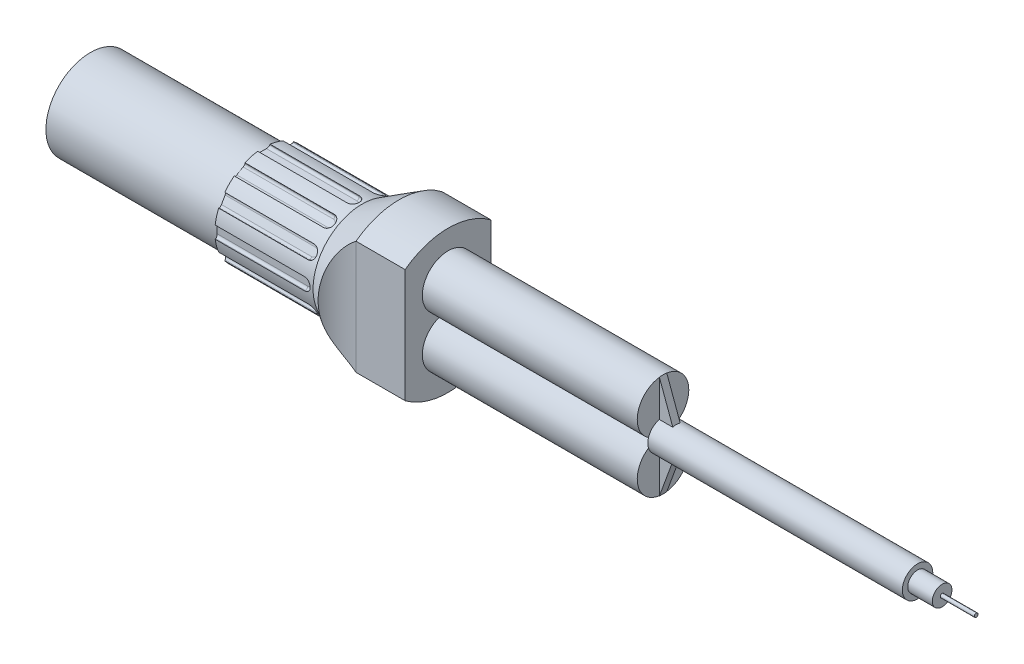
from build123d import *

# Parameters (mm, degrees)
SCHNITT_LINEAR_AUSTRAGEN1_DEPTH      = 160.040927654
SCHNITT_LINEAR_AUSTRAGEN1_DEPTH_BACK = 160.040927654
AUFSATZ_LINEAR_AUSTRAGEN3_DEPTH      = 87.5
SKIZZE5_R                            = 6.2
AUFSATZ_LINEAR_AUSTRAGEN6_DEPTH      = 103.64
AUFSATZ_LINEAR_AUSTRAGEN4_DEPTH      = 1.5
AUFSATZ_LINEAR_AUSTRAGEN4_DEPTH_BACK = 1.5
SCHNITT_LINEAR_AUSTRAGEN3_DEPTH      = 6.2
VERRUNDUNG2_R                        = 1
KREISMUSTER1_COUNT                   = 12
VERRUNDUNG2_OF_KREISMUSTER1_R        = 1
SKIZZE7_R                            = 4
AUFSATZ_LINEAR_AUSTRAGEN7_DEPTH      = 10
SKIZZE8_R                            = 0.75
AUFSATZ_LINEAR_AUSTRAGEN8_DEPTH      = 13.86


with BuildPart() as part:
    # Skizze1 → Rotation1 (revolve)
    with BuildSketch(Plane(origin=(0, 0, 0), x_dir=(1, 0, 0), z_dir=(0, 1, 0))):
        Polygon((0, 0), (0, 3.75), (3, 3.75), (8, 18.1), (78, 18.1), (78.662020906, 20), (118.662020906, 20), (133.662020906, 29), (153.662020906, 29), (153.662020906, 0), align=None)
    revolve(axis=Axis((153.662020906, 0, 0), (-1, 0, 0)))

    # Skizze2 → Schnitt-Linear austragen1 (cut, two sides: drawn at the far end of the back side and taken through both)
    with BuildSketch(Plane(origin=(0, 0, 0), x_dir=(1, 0, 0), z_dir=(0, 1, 0)).offset(-SCHNITT_LINEAR_AUSTRAGEN1_DEPTH_BACK)):
        with BuildLine():
            Line((153.662020906, 17.5), (133.662020906, 17.5))
            ThreePointArc((133.662020906, 17.5), (127.995984534, 18.992701072), (123.80085226, 23.083298813))
            Line((123.80085226, 23.083298813), (133.662020906, 29))
            Line((133.662020906, 29), (153.662020906, 29))
            Line((153.662020906, 29), (153.662020906, 17.5))
        make_face()
        with BuildLine():
            Line((123.80085226, -23.083298813), (133.662020906, -29))
            Line((133.662020906, -29), (153.662020906, -29))
            Line((153.662020906, -29), (153.662020906, -17.5))
            Line((153.662020906, -17.5), (133.662020906, -17.5))
            ThreePointArc((133.662020906, -17.5), (127.995984534, -18.992701072), (123.80085226, -23.083298813))
        make_face()
    extrude(amount=SCHNITT_LINEAR_AUSTRAGEN1_DEPTH + SCHNITT_LINEAR_AUSTRAGEN1_DEPTH_BACK, mode=Mode.SUBTRACT)

    # Skizze3 → Aufsatz-Linear austragen3 (add)
    with BuildSketch(Plane(origin=(153.662020906, 0, 0), x_dir=(0, 0, -1), z_dir=(1, 0, 0))):
        with BuildLine():
            Line((3.201562119, 0.5), (3.201562119, -0.5))
            ThreePointArc((3.201562119, -0.5), (0, -21), (-3.201562119, -0.5))
            Line((-3.201562119, -0.5), (-3.201562119, 0.5))
            ThreePointArc((-3.201562119, 0.5), (0, 21), (3.201562119, 0.5))
        make_face()
    extrude(amount=AUFSATZ_LINEAR_AUSTRAGEN3_DEPTH)

    # Skizze5 → Aufsatz-Linear austragen6 (add)
    with BuildSketch(Plane(origin=(241.162020906, 0, 0), x_dir=(0, 0, -1), z_dir=(1, 0, 0))):
        with Locations(Location((0, 0, 0), (0, 0, 162.828184851))):
            Circle(SKIZZE5_R)
    extrude(amount=AUFSATZ_LINEAR_AUSTRAGEN6_DEPTH)

    # Skizze4 → Aufsatz-Linear austragen4 (add, two sides: drawn at the far end of the back side and taken through both)
    with BuildSketch(Plane.XY.offset(-AUFSATZ_LINEAR_AUSTRAGEN4_DEPTH_BACK)):
        Polygon((241.162020906, 21), (246.662020906, 6), (241.162020906, 6), align=None)
        Polygon((246.662020906, -6), (241.162020906, -21), (241.162020906, -6), align=None)
    extrude(amount=AUFSATZ_LINEAR_AUSTRAGEN4_DEPTH + AUFSATZ_LINEAR_AUSTRAGEN4_DEPTH_BACK)

    # Skizze6 → Schnitt-Linear austragen3 (cut)
    with BuildSketch(Plane(origin=(0, 0, -18.533260872), x_dir=(1, 0, 0), z_dir=(0, 0, -1))):
        with BuildLine():
            Line((78, 2.5), (115, 2.5))
            ThreePointArc((115, 2.5), (117.5, 0), (115, -2.5))
            Line((115, -2.5), (78, -2.5))
            Line((78, -2.5), (78, 2.5))
        make_face()
    schnitt_linear_austragen3 = extrude(amount=SCHNITT_LINEAR_AUSTRAGEN3_DEPTH, mode=Mode.SUBTRACT)

    # Verrundung2
    verrundung2_edges = [part.edges().sort_by_distance(p)[0] for p in [
        (96.60472413, 2.5, -18.533260872),
        (117.5, 0, -18.533260872),
        (96.60472413, -2.5, -18.533260872),
    ]]
    fillet(verrundung2_edges, radius=VERRUNDUNG2_R)

    # Kreismuster1: Schnitt-Linear austragen3 ×12 about axis
    kreismuster1_axis = Axis((0, 0, 0), (1, 0, 0))
    for i in range(1, KREISMUSTER1_COUNT):
        add(schnitt_linear_austragen3.rotate(kreismuster1_axis, i * 360 / KREISMUSTER1_COUNT), mode=Mode.SUBTRACT)

    # Verrundung2 of Kreismuster1
    verrundung2_of_kreismuster1_edges = [part.edges().sort_by_distance(p)[0] for p in [
        (96.60472413, 11.431693945, -14.80027473),
        (117.5, 9.266630436, -16.05027473),
        (96.60472413, 7.101566926, -17.30027473),
        (96.60472413, 17.30027473, -7.101566926),
        (117.5, 16.05027473, -9.266630436),
        (96.60472413, 14.80027473, -11.431693945),
        (96.60472413, 18.533260872, 2.5),
        (117.5, 18.533260872, 0),
        (96.60472413, 18.533260872, -2.5),
        (96.60472413, 14.80027473, 11.431693945),
        (117.5, 16.05027473, 9.266630436),
        (96.60472413, 17.30027473, 7.101566926),
        (96.60472413, 7.101566926, 17.30027473),
        (117.5, 9.266630436, 16.05027473),
        (96.60472413, 11.431693945, 14.80027473),
        (96.60472413, -2.5, 18.533260872),
        (117.5, 0, 18.533260872),
        (96.60472413, 2.5, 18.533260872),
        (96.60472413, -11.431693945, 14.80027473),
        (117.5, -9.266630436, 16.05027473),
        (96.60472413, -7.101566926, 17.30027473),
        (96.60472413, -17.30027473, 7.101566926),
        (117.5, -16.05027473, 9.266630436),
        (96.60472413, -14.80027473, 11.431693945),
        (96.60472413, -18.533260872, -2.5),
        (117.5, -18.533260872, 0),
        (96.60472413, -18.533260872, 2.5),
        (96.60472413, -14.80027473, -11.431693945),
        (117.5, -16.05027473, -9.266630436),
        (96.60472413, -17.30027473, -7.101566926),
        (96.60472413, -7.101566926, -17.30027473),
        (117.5, -9.266630436, -16.05027473),
        (96.60472413, -11.431693945, -14.80027473),
    ]]
    fillet(verrundung2_of_kreismuster1_edges, radius=VERRUNDUNG2_OF_KREISMUSTER1_R)

    # Skizze7 → Aufsatz-Linear austragen7 (add)
    with BuildSketch(Plane(origin=(344.802020906, 0, 0), x_dir=(0, 0, -1), z_dir=(1, 0, 0))):
        Circle(SKIZZE7_R)
    extrude(amount=AUFSATZ_LINEAR_AUSTRAGEN7_DEPTH)

    # Skizze8 → Aufsatz-Linear austragen8 (add)
    with BuildSketch(Plane(origin=(354.802020906, 0, 0), x_dir=(0, 0, -1), z_dir=(1, 0, 0))):
        Circle(SKIZZE8_R)
    extrude(amount=AUFSATZ_LINEAR_AUSTRAGEN8_DEPTH)


solid = part.part
